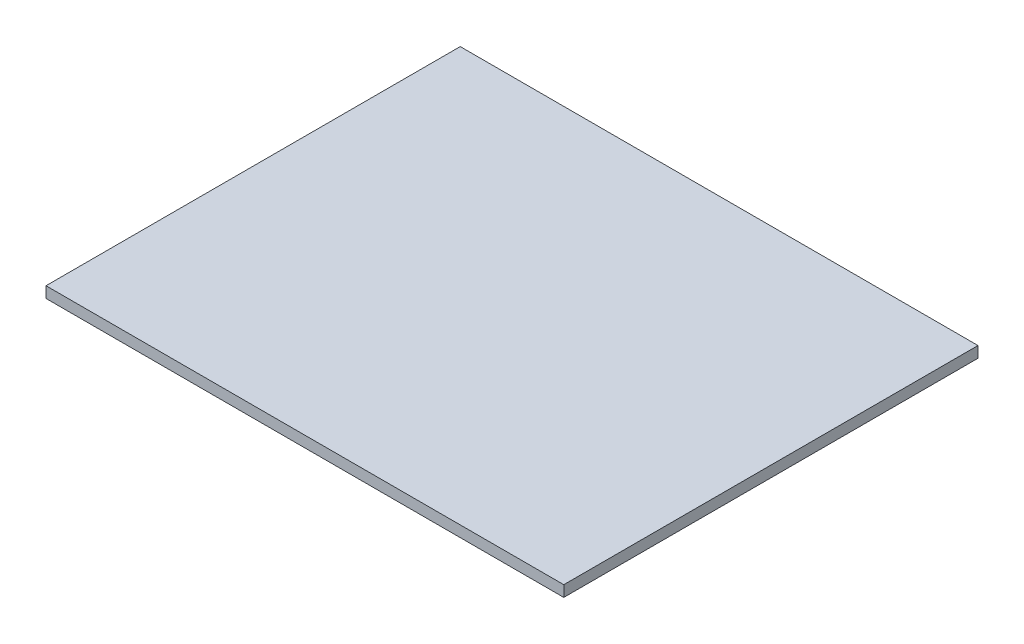
from build123d import *

# Parameters (mm, degrees)
SKETCH1_W           = 75
SKETCH1_H           = 60
BOSS_EXTRUDE1_DEPTH = 1.6


with BuildPart() as part:
    # Sketch1 → Boss-Extrude1 (new body)
    with BuildSketch(Plane(origin=(0, 0, 0), x_dir=(1, 0, 0), z_dir=(0, 1, 0))):
        Rectangle(SKETCH1_W, SKETCH1_H)
    extrude(amount=BOSS_EXTRUDE1_DEPTH)


solid = part.part
